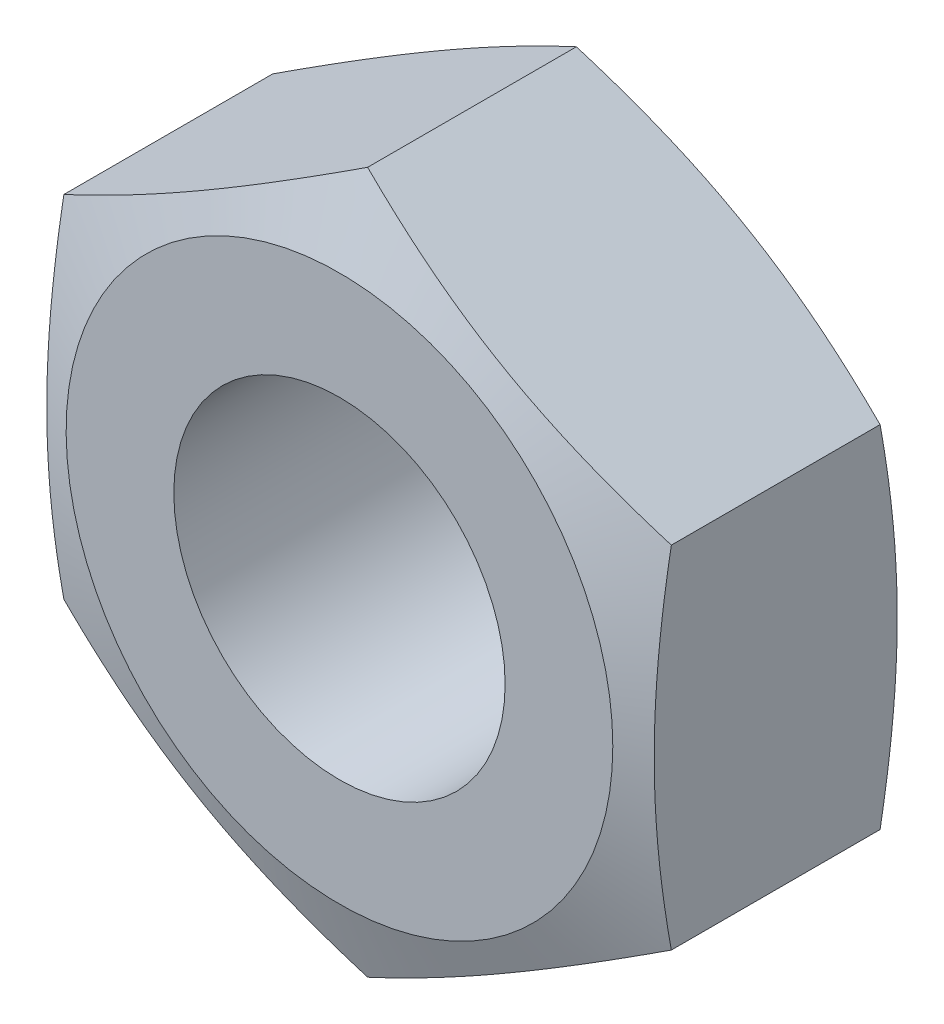
from build123d import *

# Parameters (mm, degrees)
EXTRUDE_1_DEPTH     = 2.4
SKETCH_5_R          = 1.5
CUT_EXTRUDE_1_DEPTH = 5.837957558


with BuildPart() as part:
    # 草图1 → 凸台-拉伸1 (new body)
    with BuildSketch(Plane.XY):
        Polygon((0, 3.175426481), (-2.75, 1.58771324), (-2.75, -1.58771324), (0, -3.175426481), (2.75, -1.58771324), (2.75, 1.58771324), align=None)
    extrude(amount=EXTRUDE_1_DEPTH)

    # 草图4 → 切除-旋转1 (revolve, cut)
    with BuildSketch(Plane(origin=(0, 0, 0), x_dir=(0, 0, -1), z_dir=(1, 0, 0))):
        Polygon((-2.4, -2.475), (-2.14506561, -3.175426481), (-2.4, -3.175426481), align=None)
    cut_revolve_1 = revolve(axis=Axis((0, 0, 2.4), (0, 0, -1)), mode=Mode.SUBTRACT)

    # 镜向1: 切除-旋转1 across plane
    add(cut_revolve_1.mirror(Plane.XY.offset(1.2)), mode=Mode.SUBTRACT)

    # 草图5 → 切除-拉伸1 (cut, through all)
    with BuildSketch(Plane.XY.offset(2.4)):
        Circle(SKETCH_5_R)
    extrude(amount=-CUT_EXTRUDE_1_DEPTH, mode=Mode.SUBTRACT)


solid = part.part
